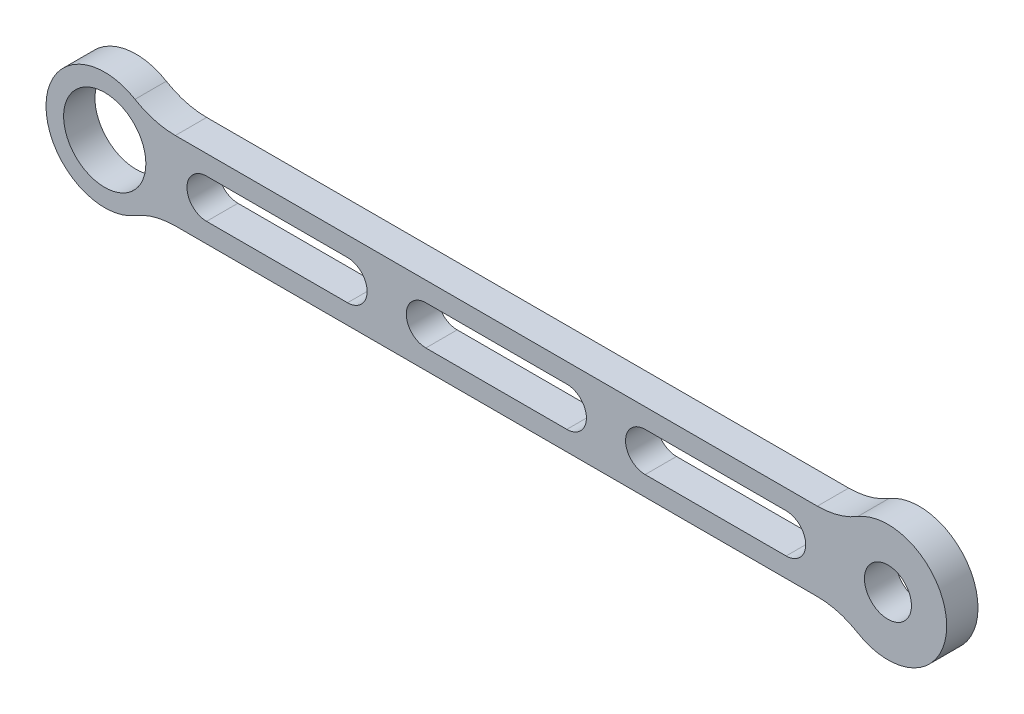
from build123d import *

# Parameters (mm, degrees)
EXTRUDE_1_DEPTH     = 8
FILLET_1_R          = 20
SKETCH_5_R          = 10.5
SKETCH_5_R_2        = 6
CUT_EXTRUDE_4_DEPTH = 10
CUT_EXTRUDE_5_DEPTH = 10


with BuildPart() as part:
    # 草图1 → 凸台-拉伸1 (new body)
    with BuildSketch(Plane.XY):
        with BuildLine():
            Line((0, -10), (0, 10))
            Line((0, 10), (11.180339887, 10))
            ThreePointArc((11.180339887, 10), (-15, 0), (11.180339887, -10))
            Line((11.180339887, -10), (0, -10))
        make_face()
        with BuildLine():
            Line((11.180339887, 10), (0, 10))
            Line((0, 10), (0, -10))
            Line((0, -10), (11.180339887, -10))
            ThreePointArc((11.180339887, -10), (14.012585384, -5.352331347), (15, 0))
            ThreePointArc((15, 0), (14.012585384, 5.352331347), (11.180339887, 10))
        make_face()
        with BuildLine():
            Line((188.819660113, 10), (11.180339887, 10))
            ThreePointArc((11.180339887, 10), (14.012585384, 5.352331347), (15, 0))
            ThreePointArc((15, 0), (14.012585384, -5.352331347), (11.180339887, -10))
            Line((11.180339887, -10), (188.819660113, -10))
            ThreePointArc((188.819660113, -10), (185, 0), (188.819660113, 10))
        make_face()
        with BuildLine():
            ThreePointArc((215, 0), (205.352331347, 14.012585384), (188.819660113, 10))
            Line((188.819660113, 10), (200, 10))
            Line((200, 10), (200, -10))
            Line((200, -10), (188.819660113, -10))
            ThreePointArc((188.819660113, -10), (205.352331347, -14.012585384), (215, 0))
        make_face()
        with BuildLine():
            Line((200, 10), (188.819660113, 10))
            ThreePointArc((188.819660113, 10), (185, 0), (188.819660113, -10))
            Line((188.819660113, -10), (200, -10))
            Line((200, -10), (200, 10))
        make_face()
    extrude(amount=EXTRUDE_1_DEPTH)

    # 圆角1
    fillet_1_edges = [part.edges().sort_by_distance(p)[0] for p in [
        (11.180339887, 10, 4),
        (188.819660113, 10, 4),
        (188.819660113, -10, 4),
        (11.180339887, -10, 4),
    ]]
    fillet(fillet_1_edges, radius=FILLET_1_R)

    # 草图5 → 切除-拉伸4 (cut)
    with BuildSketch(Plane.XY.offset(8)):
        Circle(SKETCH_5_R)
        with Locations((200, 0)):
            Circle(SKETCH_5_R_2)
    extrude(amount=-CUT_EXTRUDE_4_DEPTH, mode=Mode.SUBTRACT)

    # 草图6 → 切除-拉伸5 (cut)
    with BuildSketch(Plane.XY.offset(8)):
        with BuildLine():
            ThreePointArc((31, 0), (29.535533906, -3.535533906), (26, -5))
            Line((26, -5), (62, -5))
            ThreePointArc((62, -5), (57, 0), (62, 5))
            Line((62, 5), (26, 5))
            ThreePointArc((26, 5), (29.535533906, 3.535533906), (31, 0))
        make_face()
        with BuildLine():
            ThreePointArc((26, 5), (21, 0), (26, -5))
            Line((26, -5), (26, 5))
        make_face()
        with BuildLine():
            Line((26, 5), (26, -5))
            ThreePointArc((26, -5), (29.535533906, -3.535533906), (31, 0))
            ThreePointArc((31, 0), (29.535533906, 3.535533906), (26, 5))
        make_face()
        with BuildLine():
            ThreePointArc((62, 5), (57, 0), (62, -5))
            Line((62, -5), (62, 5))
        make_face()
        with BuildLine():
            Line((62, 5), (62, -5))
            ThreePointArc((62, -5), (65.535533906, -3.535533906), (67, 0))
            ThreePointArc((67, 0), (65.535533906, 3.535533906), (62, 5))
        make_face()
        with BuildLine():
            ThreePointArc((82, 5), (77, 0), (82, -5))
            Line((82, -5), (82, 5))
        make_face()
        with BuildLine():
            Line((82, 5), (82, -5))
            ThreePointArc((82, -5), (85.535533906, -3.535533906), (87, 0))
            ThreePointArc((87, 0), (85.535533906, 3.535533906), (82, 5))
        make_face()
        with BuildLine():
            ThreePointArc((87, 0), (85.535533906, -3.535533906), (82, -5))
            Line((82, -5), (118, -5))
            ThreePointArc((118, -5), (113, 0), (118, 5))
            Line((118, 5), (82, 5))
            ThreePointArc((82, 5), (85.535533906, 3.535533906), (87, 0))
        make_face()
        with BuildLine():
            ThreePointArc((118, 5), (113, 0), (118, -5))
            Line((118, -5), (118, 5))
        make_face()
        with BuildLine():
            Line((118, 5), (118, -5))
            ThreePointArc((118, -5), (121.535533906, -3.535533906), (123, 0))
            ThreePointArc((123, 0), (121.535533906, 3.535533906), (118, 5))
        make_face()
        with BuildLine():
            ThreePointArc((138, 5), (133, 0), (138, -5))
            Line((138, -5), (138, 5))
        make_face()
        with BuildLine():
            Line((138, 5), (138, -5))
            ThreePointArc((138, -5), (141.535533906, -3.535533906), (143, 0))
            ThreePointArc((143, 0), (141.535533906, 3.535533906), (138, 5))
        make_face()
        with BuildLine():
            ThreePointArc((143, 0), (141.535533906, -3.535533906), (138, -5))
            Line((138, -5), (174, -5))
            ThreePointArc((174, -5), (169, 0), (174, 5))
            Line((174, 5), (138, 5))
            ThreePointArc((138, 5), (141.535533906, 3.535533906), (143, 0))
        make_face()
        with BuildLine():
            ThreePointArc((174, 5), (169, 0), (174, -5))
            Line((174, -5), (174, 5))
        make_face()
        with BuildLine():
            Line((174, 5), (174, -5))
            ThreePointArc((174, -5), (177.535533906, -3.535533906), (179, 0))
            ThreePointArc((179, 0), (177.535533906, 3.535533906), (174, 5))
        make_face()
    extrude(amount=-CUT_EXTRUDE_5_DEPTH, mode=Mode.SUBTRACT)


solid = part.part
